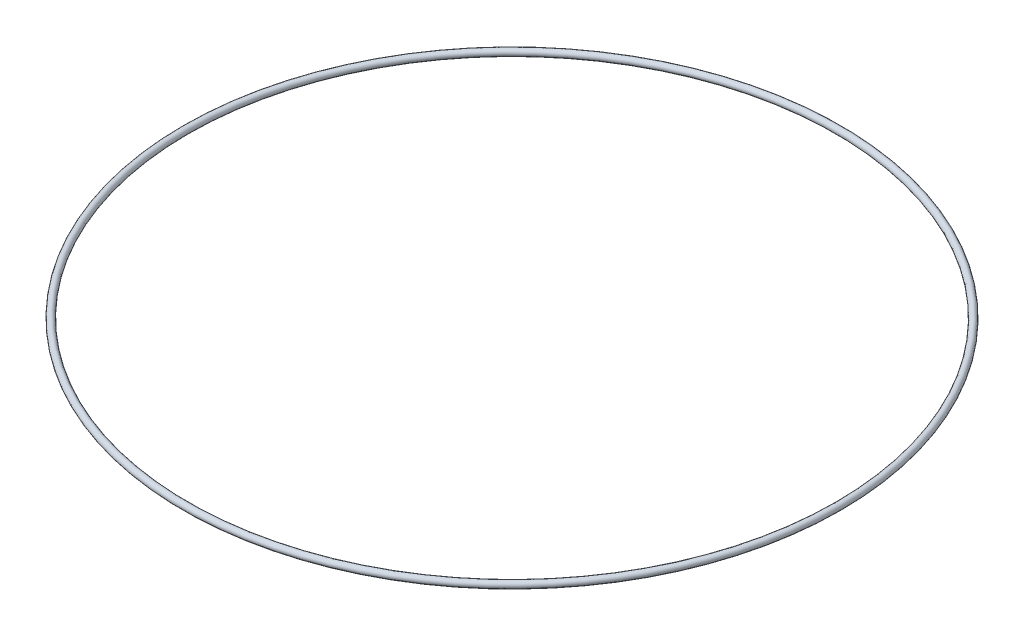
from build123d import *

# Parameters (mm, degrees)
SKETCH1_R   = 9.525
SKETCH1_R_2 = 7.62


with BuildPart() as part:
    # Sketch1 → Revolve1 (revolve)
    with BuildSketch(Plane(origin=(0, -224.794004951, 0), x_dir=(1, 0, 0), z_dir=(0, 0, 1))):
        with Locations((-914.4, 0)):
            Circle(SKETCH1_R)
        with Locations((-914.4, 0)):
            Circle(SKETCH1_R_2, mode=Mode.SUBTRACT)
    revolve(axis=Axis((0, 147.891113998, 0), (0, -1, 0)))


solid = part.part
